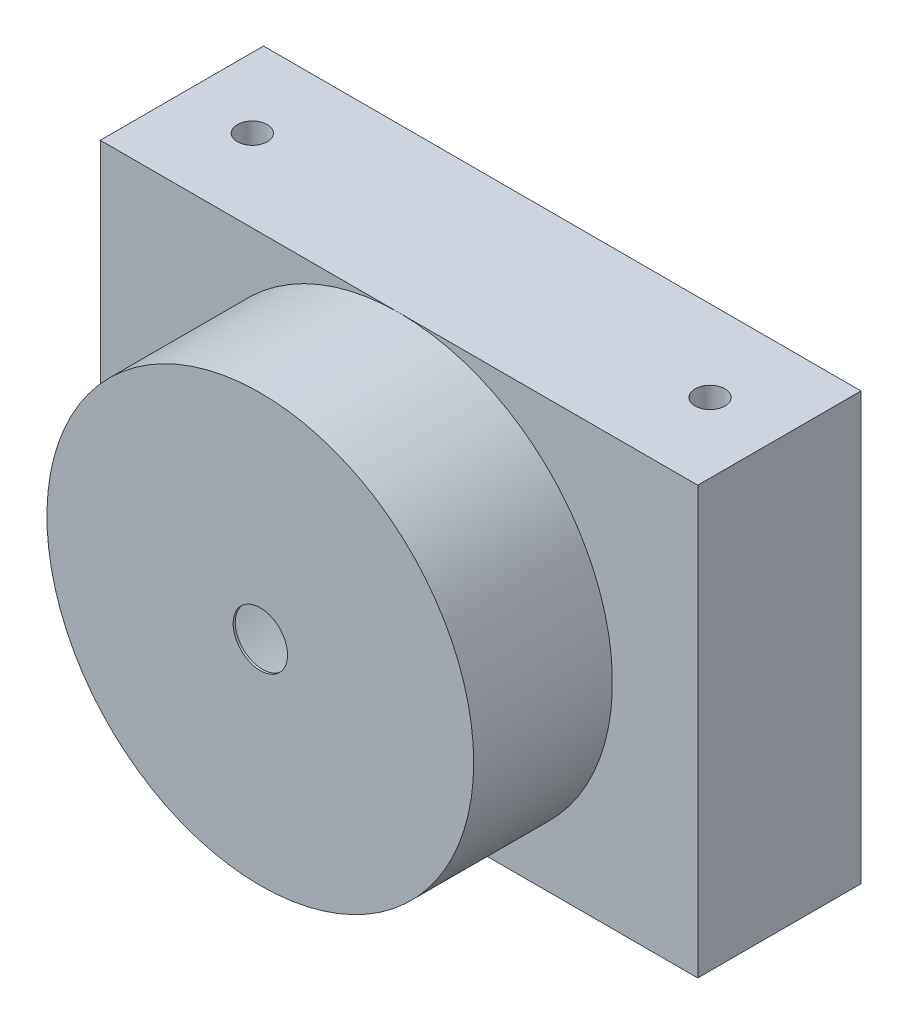
from build123d import *

# Parameters (mm, degrees)
ESQUISSE1_W             = 56
ESQUISSE1_H             = 40
BOSS_EXTRU_1_DEPTH      = 15.3
ESQUISSE2_R             = 20
BOSS_EXTRU_2_DEPTH      = 13
ESQUISSE5_R             = 1.4
ENL_V_MAT_EXTRU_1_DEPTH = 5
ESQUISSE6_R             = 16
ENL_V_MAT_EXTRU_2_DEPTH = 28.1
ESQUISSE3_R             = 2.55
ENL_V_MAT_EXTRU_3_DEPTH = 28


with BuildPart() as part:
    # Esquisse1 → Boss.-Extru.1 (new body)
    with BuildSketch(Plane.XY):
        Rectangle(ESQUISSE1_W, ESQUISSE1_H)
    extrude(amount=BOSS_EXTRU_1_DEPTH)

    # Esquisse2 → Boss.-Extru.2 (add)
    with BuildSketch(Plane.XY.offset(15.3)):
        with Locations(Location((0, 0, 0), (0, 0, 270))):
            Circle(ESQUISSE2_R)
    extrude(amount=BOSS_EXTRU_2_DEPTH)

    # Esquisse5 → Enlèv. mat.-Extru.1 (cut)
    with BuildSketch(Plane(origin=(0, 20, 0), x_dir=(1, 0, 0), z_dir=(0, 1, 0))):
        with Locations(Location((-21.45, -7.6, 0), (0, 0, 180))):
            Circle(ESQUISSE5_R)
        with Locations(Location((21.45, -7.6, 0), (0, 0, 180))):
            Circle(ESQUISSE5_R)
    extrude(amount=-ENL_V_MAT_EXTRU_1_DEPTH, mode=Mode.SUBTRACT)

    # Esquisse6 → Enlèv. mat.-Extru.2 (cut)
    with BuildSketch(Plane(origin=(0, 0, 0), x_dir=(-1, 0, 0), z_dir=(0, 0, -1))):
        Circle(ESQUISSE6_R)
    extrude(amount=-ENL_V_MAT_EXTRU_2_DEPTH, mode=Mode.SUBTRACT)

    # Esquisse3 → Enlèv. mat.-Extru.3 (cut)
    with BuildSketch(Plane.XY.offset(28.3)):
        Circle(ESQUISSE3_R)
    extrude(amount=-ENL_V_MAT_EXTRU_3_DEPTH, mode=Mode.SUBTRACT)


solid = part.part
